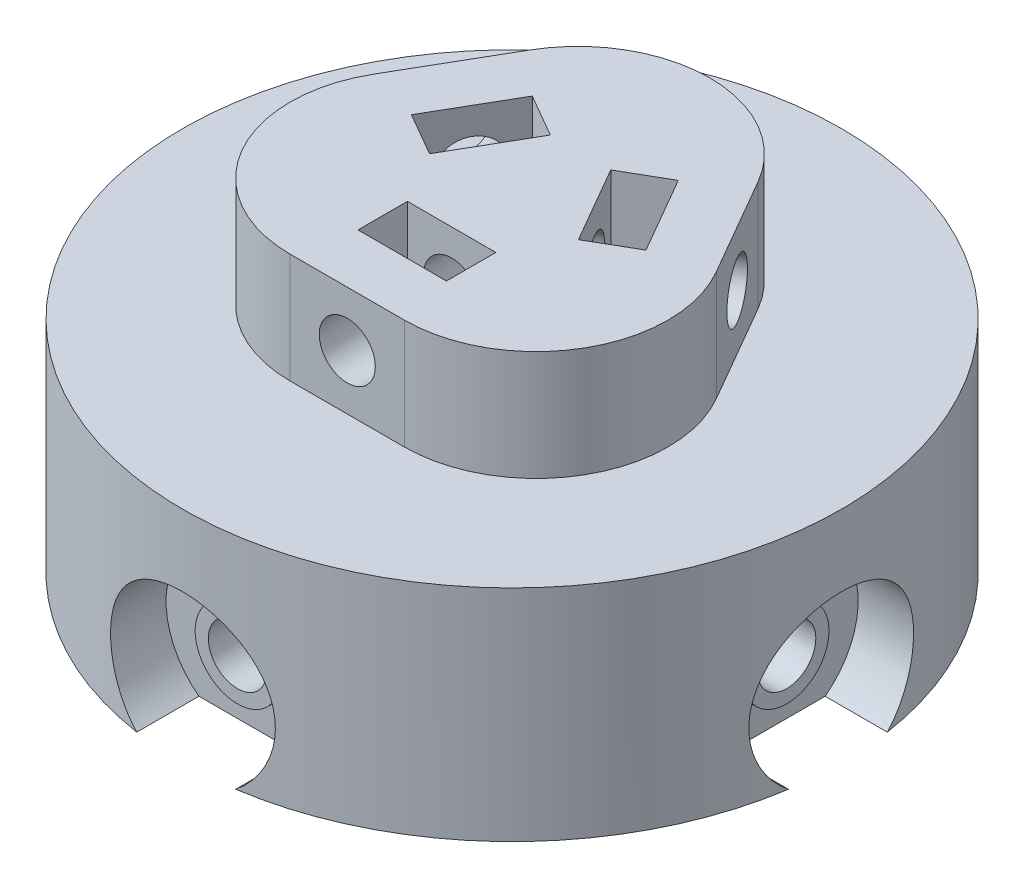
from build123d import *

# Parameters (mm, degrees)
SKETCH1_R                = 30
BOSS_EXTRUDE1_DEPTH      = 20
SHELL1_T                 = 4
CUT_EXTRUDE1_REACH       = 48.904
SKETCH2_R                = 20.15
BOSS_EXTRUDE2_REACH      = 74
BOSS_EXTRUDE2_END_RADIUS = 20.15
BOSS_EXTRUDE2_START      = -2
SKETCH3_R                = 7.5
CUT_EXTRUDE2_DEPTH       = 5
CUT_EXTRUDE4_REACH       = 72
CUT_EXTRUDE4_END_RADIUS  = 20.15
SKETCH5_R                = 2.65
SKETCH8_R                = 3.85
CUT_EXTRUDE6_DEPTH       = 1
CIRPATTERN1_COUNT        = 4
BOSS_EXTRUDE3_DEPTH      = 10
SKETCH16_R               = 2.55
CUT_EXTRUDE7_DEPTH       = 15
CUT_EXTRUDE8_START       = -5
CUT_EXTRUDE8_DEPTH       = 4.5
CIRPATTERN2_COUNT        = 3
FILLET1_R                = 12


with BuildPart() as part:
    # Sketch1 → Boss-Extrude1 (new body)
    with BuildSketch(Plane(origin=(0, 0, 0), x_dir=(1, 0, 0), z_dir=(0, 1, 0))):
        with Locations(Location((0, 0, 0), (0, 0, 270))):
            Circle(SKETCH1_R)
    extrude(amount=BOSS_EXTRUDE1_DEPTH)

    # Shell1 (no face opened: a closed hollow body)
    add(offset(amount=-SHELL1_T, mode=Mode.PRIVATE), mode=Mode.SUBTRACT)

    # Sketch2 → Cut-Extrude1 (cut, up to next)
    with BuildSketch(Plane.XZ, mode=Mode.PRIVATE) as cut_extrude1_sk1:
        with Locations(Location((0, 0, 0), (0, 0, 270))):
            Circle(SKETCH2_R)
    cut_extrude1_tool1 = extrude(cut_extrude1_sk1.sketch, amount=-CUT_EXTRUDE1_REACH, mode=Mode.PRIVATE) & part.part
    add(cut_extrude1_tool1.solids().sort_by_distance((0, 0, 0))[0], mode=Mode.SUBTRACT)

    # Boss-Extrude2: up to this cylinder (the profile starts outside it)
    boss_extrude2_end = Plane(origin=(0, 7.698875, 0), z_dir=(0, -1, 0)) * Cylinder(BOSS_EXTRUDE2_END_RADIUS, 189.3, mode=Mode.PRIVATE)
    # Sketch7 → Boss-Extrude2 (add, up to the surface)
    with BuildSketch(Plane.ZY.offset(30).offset(BOSS_EXTRUDE2_START), mode=Mode.PRIVATE) as boss_extrude2_sk1:
        with BuildLine():
            Line((-8, 0), (8, 0))
            Line((8, 0), (8, 11))
            ThreePointArc((8, 11), (6.535533906, 14.535533906), (3, 16))
            Line((3, 16), (-3, 16))
            ThreePointArc((-3, 16), (-6.535533906, 14.535533906), (-8, 11))
            Line((-8, 11), (-8, 0))
        make_face()
    boss_extrude2_tool1 = extrude(boss_extrude2_sk1.sketch, amount=-BOSS_EXTRUDE2_REACH, mode=Mode.PRIVATE) - boss_extrude2_end
    boss_extrude2 = boss_extrude2_tool1.solids().sort_by_distance((-28, 7.698875, 0))[0]
    add(boss_extrude2)

    # Sketch3 → Cut-Extrude2 (cut)
    with BuildSketch(Plane(origin=(-30, 0, -30), x_dir=(0, 0, -1), z_dir=(1, 0, 0))):
        with Locations((-30, 6)):
            Circle(SKETCH3_R)
    cut_extrude2 = extrude(amount=CUT_EXTRUDE2_DEPTH, mode=Mode.SUBTRACT)

    # Cut-Extrude4: up to this cylinder (the profile starts outside it)
    cut_extrude4_end = Plane(origin=(0, 6, 0), z_dir=(0, -1, 0)) * Cylinder(CUT_EXTRUDE4_END_RADIUS, 185.3, mode=Mode.PRIVATE)
    # Sketch5 → Cut-Extrude4 (cut, up to the surface)
    with BuildSketch(Plane.ZY.offset(30), mode=Mode.PRIVATE) as cut_extrude4_sk1:
        with Locations((0, 6)):
            Circle(SKETCH5_R)
    cut_extrude4_tool1 = extrude(cut_extrude4_sk1.sketch, amount=-CUT_EXTRUDE4_REACH, mode=Mode.PRIVATE) - cut_extrude4_end
    cut_extrude4 = cut_extrude4_tool1.solids().sort_by_distance((-30, 6, 0))[0]
    add(cut_extrude4, mode=Mode.SUBTRACT)

    # Sketch8 → Cut-Extrude6 (cut)
    with BuildSketch(Plane.ZY.offset(25)):
        with BuildLine():
            Line((-4.5, 0), (4.5, 0))
            ThreePointArc((4.5, 0), (0, 13.5), (-4.5, 0))
        make_face()
        with Locations((0, 6)):
            Circle(SKETCH8_R, mode=Mode.SUBTRACT)
    cut_extrude6 = extrude(amount=-CUT_EXTRUDE6_DEPTH, mode=Mode.SUBTRACT)

    # CirPattern1: Boss-Extrude2, Cut-Extrude2, Cut-Extrude4, Cut-Extrude6 ×4 about axis
    cirpattern1_axis = Axis((0, 0, 0), (0, 1, 0))
    add([boss_extrude2.rotate(cirpattern1_axis, i * 360 / CIRPATTERN1_COUNT) for i in range(1, CIRPATTERN1_COUNT)])
    add([cut_extrude2.rotate(cirpattern1_axis, i * 360 / CIRPATTERN1_COUNT) for i in range(1, CIRPATTERN1_COUNT)], mode=Mode.SUBTRACT)
    add([cut_extrude4.rotate(cirpattern1_axis, i * 360 / CIRPATTERN1_COUNT) for i in range(1, CIRPATTERN1_COUNT)], mode=Mode.SUBTRACT)
    add([cut_extrude6.rotate(cirpattern1_axis, i * 360 / CIRPATTERN1_COUNT) for i in range(1, CIRPATTERN1_COUNT)], mode=Mode.SUBTRACT)

    # Sketch14 → Boss-Extrude3 (add)
    with BuildSketch(Plane(origin=(0, 20, 0), x_dir=(1, 0, 0), z_dir=(0, 1, 0))):
        Polygon((0, 30), (-25.980762114, -15), (25.980762114, -15), align=None)
    extrude(amount=BOSS_EXTRUDE3_DEPTH)

    # Sketch16 → Cut-Extrude7 (cut)
    with BuildSketch(Plane(origin=(-12.990381057, 0, -7.5), x_dir=(-0.5000000000000002, 0, 0.8660254037844386), z_dir=(-0.8660254037844385, 0, -0.5000000000000001))):
        with Locations((0, 25)):
            Circle(SKETCH16_R)
    cut_extrude7 = extrude(amount=-CUT_EXTRUDE7_DEPTH, mode=Mode.SUBTRACT)

    # Sketch17 → Cut-Extrude8 (cut)
    with BuildSketch(Plane(origin=(-12.990381057, 0, -7.5), x_dir=(-0.5000000000000002, 0, 0.8660254037844386), z_dir=(-0.8660254037844385, 0, -0.5000000000000001)).offset(CUT_EXTRUDE8_START)):
        Polygon((0, 20.352330333), (4.025, 22.676165167), (4.025, 27.352702347), (4.025, 30), (-4.025, 30), (-4.025, 27.323834833), (-4.025, 22.676165167), align=None)
    cut_extrude8 = extrude(amount=-CUT_EXTRUDE8_DEPTH, mode=Mode.SUBTRACT)

    # CirPattern2: Cut-Extrude7, Cut-Extrude8 ×3 about axis
    cirpattern2_axis = Axis((0, 0, 0), (0, 1, 0))
    add([cut_extrude7.rotate(cirpattern2_axis, i * 360 / CIRPATTERN2_COUNT) for i in range(1, CIRPATTERN2_COUNT)], mode=Mode.SUBTRACT)
    add([cut_extrude8.rotate(cirpattern2_axis, i * 360 / CIRPATTERN2_COUNT) for i in range(1, CIRPATTERN2_COUNT)], mode=Mode.SUBTRACT)

    # Fillet1
    fillet1_edges = [part.edges().sort_by_distance(p)[0] for p in [
        (25.980762114, 25, 15),
        (0, 25, -30),
        (-25.980762114, 25, 15),
    ]]
    fillet(fillet1_edges, radius=FILLET1_R)


solid = part.part
